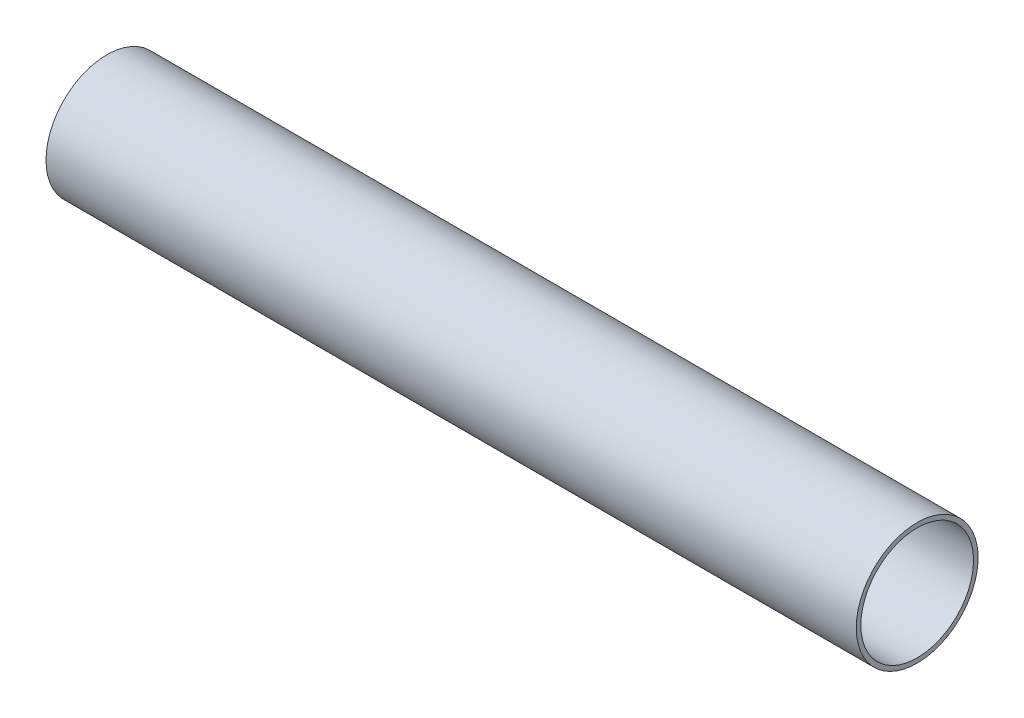
from build123d import *

# Parameters (mm, degrees)
SKETCH1_R           = 17.171437949
SKETCH1_R_2         = 15.875
BOSS_EXTRUDE1_DEPTH = 114.173


with BuildPart() as part:
    # Sketch1 → Boss-Extrude1 (new, symmetric)
    with BuildSketch(Plane(origin=(0, 0, 0), x_dir=(0, 0, -1), z_dir=(1, 0, 0))):
        with Locations(Location((0, 0, 0), (0, 0, 180))):
            Circle(SKETCH1_R)
        with Locations(Location((0, 0, 0), (0, 0, 180))):
            Circle(SKETCH1_R_2, mode=Mode.SUBTRACT)
    extrude(amount=BOSS_EXTRUDE1_DEPTH, both=True)


solid = part.part
